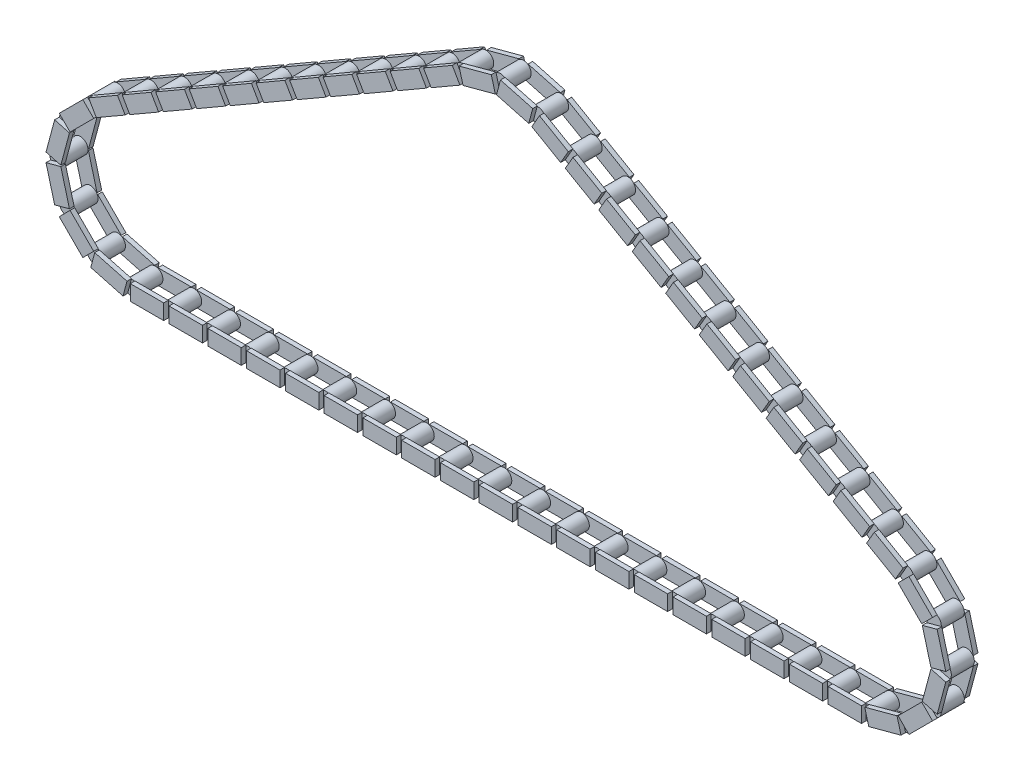
from build123d import *

# Parameters (mm, degrees)
BOTTOM_LINK_PLATES_DEPTH    = 1.2
BOTTOM_LINK_PLATES_2_DEPTH  = 1.2
BOTTOM_LINK_PLATES_3_DEPTH  = 1.2
BOTTOM_LINK_PLATES_4_DEPTH  = 1.2
BOTTOM_LINK_PLATES_5_DEPTH  = 1.2
BOTTOM_LINK_PLATES_6_DEPTH  = 1.2
BOTTOM_LINK_PLATES_7_DEPTH  = 1.2
BOTTOM_LINK_PLATES_8_DEPTH  = 1.2
BOTTOM_LINK_PLATES_9_DEPTH  = 1.2
BOTTOM_LINK_PLATES_10_DEPTH = 1.2
BOTTOM_LINK_PLATES_11_DEPTH = 1.2
BOTTOM_LINK_PLATES_12_DEPTH = 1.2
BOTTOM_LINK_PLATES_13_DEPTH = 1.2
BOTTOM_LINK_PLATES_14_DEPTH = 1.2
BOTTOM_LINK_PLATES_15_DEPTH = 1.2
BOTTOM_LINK_PLATES_16_DEPTH = 1.2
BOTTOM_LINK_PLATES_17_DEPTH = 1.2
BOTTOM_LINK_PLATES_18_DEPTH = 1.2
BOTTOM_LINK_PLATES_19_DEPTH = 1.2
BOTTOM_LINK_PLATES_20_DEPTH = 1.2
BOTTOM_LINK_PLATES_21_DEPTH = 1.2
BOTTOM_LINK_PLATES_22_DEPTH = 1.2
BOTTOM_LINK_PLATES_23_DEPTH = 1.2
BOTTOM_LINK_PLATES_24_DEPTH = 1.2
BOTTOM_LINK_PLATES_25_DEPTH = 1.2
BOTTOM_LINK_PLATES_26_DEPTH = 1.2
BOTTOM_LINK_PLATES_27_DEPTH = 1.2
BOTTOM_LINK_PLATES_28_DEPTH = 1.2
BOTTOM_LINK_PLATES_29_DEPTH = 1.2
BOTTOM_LINK_PLATES_30_DEPTH = 1.2
BOTTOM_LINK_PLATES_31_DEPTH = 1.2
BOTTOM_LINK_PLATES_32_DEPTH = 1.2
BOTTOM_LINK_PLATES_33_DEPTH = 1.2
BOTTOM_LINK_PLATES_34_DEPTH = 1.2
SKETCH_1_W                  = 8.705263365
SKETCH_1_H                  = 4
BOTTOM_LINK_PLATES_35_DEPTH = 1.2
BOTTOM_LINK_PLATES_36_DEPTH = 1.2
SKETCH_1_W_2                = 8.705263366
BOTTOM_LINK_PLATES_37_DEPTH = 1.2
BOTTOM_LINK_PLATES_38_DEPTH = 1.2
BOTTOM_LINK_PLATES_39_DEPTH = 1.2
BOTTOM_LINK_PLATES_40_DEPTH = 1.2
BOTTOM_LINK_PLATES_41_DEPTH = 1.2
BOTTOM_LINK_PLATES_42_DEPTH = 1.2
BOTTOM_LINK_PLATES_43_DEPTH = 1.2
BOTTOM_LINK_PLATES_44_DEPTH = 1.2
BOTTOM_LINK_PLATES_45_DEPTH = 1.2
BOTTOM_LINK_PLATES_46_DEPTH = 1.2
BOTTOM_LINK_PLATES_47_DEPTH = 1.2
BOTTOM_LINK_PLATES_48_DEPTH = 1.2
BOTTOM_LINK_PLATES_49_DEPTH = 1.2
BOTTOM_LINK_PLATES_50_DEPTH = 1.2
BOTTOM_LINK_PLATES_51_DEPTH = 1.2
BOTTOM_LINK_PLATES_52_DEPTH = 1.2
BOTTOM_LINK_PLATES_53_DEPTH = 1.2
SKETCH_3_R                  = 2
ROLLERS_DEPTH               = 6
SKETCH_5_W                  = 8.705263365
SKETCH_5_H                  = 4
SKETCH_5_W_2                = 8.705263366
TOP_LINK_PLATES_DEPTH       = 1.2


with BuildPart() as part:
    # 草图1 → Bottom_link_plates (new body)
    with BuildSketch(Plane.XY):
        Polygon((-97.193786169, -21.272547652), (-105.602424677, -19.019459754), (-104.567148497, -15.155756449), (-96.158509988, -17.408844347), align=None)
    extrude(amount=BOTTOM_LINK_PLATES_DEPTH)



with BuildPart() as body_2:
    # 草图1 → Bottom_link_plates 2 (new body)
    with BuildSketch(Plane.XY):
        Polygon((-107.670122975, -17.825673586), (-113.825673586, -11.670122975), (-110.997246461, -8.84169585), (-104.84169585, -14.997246461), align=None)
    extrude(amount=BOTTOM_LINK_PLATES_2_DEPTH)


with BuildPart() as body_3:
    # 草图1 → Bottom_link_plates 3 (new body)
    with BuildSketch(Plane.XY):
        Polygon((-115.019459754, -9.602424677), (-117.272547652, -1.193786169), (-113.408844347, -0.158509988), (-111.155756449, -8.567148497), align=None)
    extrude(amount=BOTTOM_LINK_PLATES_3_DEPTH)


with BuildPart() as body_4:
    # 草图1 → Bottom_link_plates 4 (new body)
    with BuildSketch(Plane.XY):
        Polygon((-117.272547652, 1.193786169), (-115.019459754, 9.602424677), (-111.155756449, 8.567148497), (-113.408844347, 0.158509988), align=None)
    extrude(amount=BOTTOM_LINK_PLATES_4_DEPTH)


with BuildPart() as body_5:
    # 草图1 → Bottom_link_plates 5 (new body)
    with BuildSketch(Plane.XY):
        Polygon((-113.825673586, 11.670122975), (-107.670122975, 17.825673586), (-104.84169585, 14.997246461), (-110.997246461, 8.84169585), align=None)
    extrude(amount=BOTTOM_LINK_PLATES_5_DEPTH)


with BuildPart() as body_6:
    # 草图1 → Bottom_link_plates 6 (new body)
    with BuildSketch(Plane.XY):
        Polygon((-106.154716463, 18.988485657), (-98.639879132, 23.32717699), (-96.639879831, 19.863074971), (-104.154717162, 15.524383638), align=None)
    extrude(amount=BOTTOM_LINK_PLATES_6_DEPTH)


with BuildPart() as body_7:
    # 草图1 → Bottom_link_plates 7 (new body)
    with BuildSketch(Plane.XY):
        Polygon((-97.427443425, 24.027176746), (-89.912606094, 28.365868079), (-87.912606794, 24.90176606), (-95.427444124, 20.563074727), align=None)
    extrude(amount=BOTTOM_LINK_PLATES_7_DEPTH)


with BuildPart() as body_8:
    # 草图1 → Bottom_link_plates 8 (new body)
    with BuildSketch(Plane.XY):
        Polygon((-88.700170388, 29.065867834), (-81.185333057, 33.404559167), (-79.185333756, 29.940457148), (-86.700171087, 25.601765815), align=None)
    extrude(amount=BOTTOM_LINK_PLATES_8_DEPTH)


with BuildPart() as body_9:
    # 草图1 → Bottom_link_plates 9 (new body)
    with BuildSketch(Plane.XY):
        Polygon((-79.97289735, 34.104558922), (-72.458060019, 38.443250255), (-70.458060718, 34.979148236), (-77.972898049, 30.640456903), align=None)
    extrude(amount=BOTTOM_LINK_PLATES_9_DEPTH)


with BuildPart() as body_10:
    # 草图1 → Bottom_link_plates 10 (new body)
    with BuildSketch(Plane.XY):
        Polygon((-71.245624312, 39.14325001), (-63.730786981, 43.481941343), (-61.730787681, 40.017839324), (-69.245625012, 35.679147991), align=None)
    extrude(amount=BOTTOM_LINK_PLATES_10_DEPTH)


with BuildPart() as body_11:
    # 草图1 → Bottom_link_plates 11 (new body)
    with BuildSketch(Plane.XY):
        Polygon((-62.518351275, 44.181941099), (-55.003513944, 48.520632432), (-53.003514643, 45.056530413), (-60.518351974, 40.71783908), align=None)
    extrude(amount=BOTTOM_LINK_PLATES_11_DEPTH)


with BuildPart() as body_12:
    # 草图1 → Bottom_link_plates 12 (new body)
    with BuildSketch(Plane.XY):
        Polygon((-53.791078237, 49.220632187), (-46.276240906, 53.55932352), (-44.276241606, 50.095221501), (-51.791078937, 45.756530168), align=None)
    extrude(amount=BOTTOM_LINK_PLATES_12_DEPTH)


with BuildPart() as body_13:
    # 草图1 → Bottom_link_plates 13 (new body)
    with BuildSketch(Plane.XY):
        Polygon((-45.0638052, 54.259323275), (-37.548967869, 58.598014608), (-35.548968568, 55.133912589), (-43.063805899, 50.795221256), align=None)
    extrude(amount=BOTTOM_LINK_PLATES_13_DEPTH)


with BuildPart() as body_14:
    # 草图1 → Bottom_link_plates 14 (new body)
    with BuildSketch(Plane.XY):
        Polygon((-36.336532162, 59.298014363), (-28.821694831, 63.636705696), (-26.821695531, 60.172603677), (-34.336532861, 55.833912344), align=None)
    extrude(amount=BOTTOM_LINK_PLATES_14_DEPTH)


with BuildPart() as body_15:
    # 草图1 → Bottom_link_plates 15 (new body)
    with BuildSketch(Plane.XY):
        Polygon((-27.609259125, 64.336705452), (-20.094421794, 68.675396785), (-18.094422493, 65.211294766), (-25.609259824, 60.872603433), align=None)
    extrude(amount=BOTTOM_LINK_PLATES_15_DEPTH)


with BuildPart() as body_16:
    # 草图1 → Bottom_link_plates 16 (new body)
    with BuildSketch(Plane.XY):
        Polygon((-18.881986087, 69.37539654), (-11.367148756, 73.714087873), (-9.367149455, 70.249985854), (-16.881986786, 65.911294521), align=None)
    extrude(amount=BOTTOM_LINK_PLATES_16_DEPTH)


with BuildPart() as body_17:
    # 草图1 → Bottom_link_plates 17 (new body)
    with BuildSketch(Plane.XY):
        Polygon((-9.602420838, 74.445061693), (-1.193781874, 76.698147893), (-0.158506473, 72.834444379), (-8.567145437, 70.581358179), align=None)
    extrude(amount=BOTTOM_LINK_PLATES_17_DEPTH)


with BuildPart() as body_18:
    # 草图1 → Bottom_link_plates 18 (new body)
    with BuildSketch(Plane.XY):
        Polygon((1.193790463, 76.698147411), (9.602428517, 74.445057816), (8.567151557, 70.58135472), (0.158513503, 72.834444315), align=None)
    extrude(amount=BOTTOM_LINK_PLATES_18_DEPTH)


with BuildPart() as body_19:
    # 草图1 → Bottom_link_plates 19 (new body)
    with BuildSketch(Plane.XY):
        Polygon((11.367155583, 73.714083931), (18.881991983, 69.375393136), (16.881992682, 65.911291117), (9.367156282, 70.249981913), align=None)
    extrude(amount=BOTTOM_LINK_PLATES_19_DEPTH)


with BuildPart() as body_20:
    # 草图1 → Bottom_link_plates 20 (new body)
    with BuildSketch(Plane.XY):
        Polygon((20.094427689, 68.675393381), (27.609264089, 64.336702585), (25.609264789, 60.872600566), (18.094428389, 65.211291362), align=None)
    extrude(amount=BOTTOM_LINK_PLATES_20_DEPTH)


with BuildPart() as body_21:
    # 草图1 → Bottom_link_plates 21 (new body)
    with BuildSketch(Plane.XY):
        Polygon((28.821699796, 63.63670283), (36.336536196, 59.298012034), (34.336536895, 55.833910015), (26.821700495, 60.172600811), align=None)
    extrude(amount=BOTTOM_LINK_PLATES_21_DEPTH)


with BuildPart() as body_22:
    # 草图1 → Bottom_link_plates 22 (new body)
    with BuildSketch(Plane.XY):
        Polygon((37.548971903, 58.598012279), (45.063808303, 54.259321484), (43.063809002, 50.795219465), (35.548972602, 55.13391026), align=None)
    extrude(amount=BOTTOM_LINK_PLATES_22_DEPTH)


with BuildPart() as body_23:
    # 草图1 → Bottom_link_plates 23 (new body)
    with BuildSketch(Plane.XY):
        Polygon((46.276244009, 53.559321728), (53.791080409, 49.220630933), (51.791081109, 45.756528914), (44.276244709, 50.095219709), align=None)
    extrude(amount=BOTTOM_LINK_PLATES_23_DEPTH)


with BuildPart() as body_24:
    # 草图1 → Bottom_link_plates 24 (new body)
    with BuildSketch(Plane.XY):
        Polygon((55.003516116, 48.520631178), (62.518352516, 44.181940382), (60.518353215, 40.717838363), (53.003516815, 45.056529159), align=None)
    extrude(amount=BOTTOM_LINK_PLATES_24_DEPTH)


with BuildPart() as body_25:
    # 草图1 → Bottom_link_plates 25 (new body)
    with BuildSketch(Plane.XY):
        Polygon((63.730788223, 43.481940627), (71.245624623, 39.143249831), (69.245625322, 35.679147812), (61.730788922, 40.017838608), align=None)
    extrude(amount=BOTTOM_LINK_PLATES_25_DEPTH)


with BuildPart() as body_26:
    # 草图1 → Bottom_link_plates 26 (new body)
    with BuildSketch(Plane.XY):
        Polygon((72.458060329, 38.443250076), (79.972896729, 34.10455928), (77.972897429, 30.640457261), (70.458061029, 34.979148057), align=None)
    extrude(amount=BOTTOM_LINK_PLATES_26_DEPTH)


with BuildPart() as body_27:
    # 草图1 → Bottom_link_plates 27 (new body)
    with BuildSketch(Plane.XY):
        Polygon((81.185332436, 33.404559525), (88.700168836, 29.06586873), (86.700169535, 25.601766711), (79.185333135, 29.940457506), align=None)
    extrude(amount=BOTTOM_LINK_PLATES_27_DEPTH)


with BuildPart() as body_28:
    # 草图1 → Bottom_link_plates 28 (new body)
    with BuildSketch(Plane.XY):
        Polygon((89.912604543, 28.365868974), (97.427440943, 24.027178179), (95.427441642, 20.56307616), (87.912605242, 24.901766955), align=None)
    extrude(amount=BOTTOM_LINK_PLATES_28_DEPTH)


with BuildPart() as body_29:
    # 草图1 → Bottom_link_plates 29 (new body)
    with BuildSketch(Plane.XY):
        Polygon((98.639876649, 23.327178424), (106.154713049, 18.988487628), (104.154713749, 15.524385609), (96.639877349, 19.863076405), align=None)
    extrude(amount=BOTTOM_LINK_PLATES_29_DEPTH)


with BuildPart() as body_30:
    # 草图1 → Bottom_link_plates 30 (new body)
    with BuildSketch(Plane.XY):
        Polygon((107.670119376, 17.825675942), (113.82567123, 11.670126574), (110.997244676, 8.841698878), (104.841692822, 14.997248246), align=None)
    extrude(amount=BOTTOM_LINK_PLATES_30_DEPTH)


with BuildPart() as body_31:
    # 草图1 → Bottom_link_plates 31 (new body)
    with BuildSketch(Plane.XY):
        Polygon((115.019457816, 9.602428517), (117.272547411, 1.193790463), (113.408844315, 0.158513503), (111.15575472, 8.567151557), align=None)
    extrude(amount=BOTTOM_LINK_PLATES_31_DEPTH)


with BuildPart() as body_32:
    # 草图1 → Bottom_link_plates 32 (new body)
    with BuildSketch(Plane.XY):
        Polygon((117.272547893, -1.193781874), (115.019461693, -9.602420838), (111.155758179, -8.567145437), (113.408844379, -0.158506473), align=None)
    extrude(amount=BOTTOM_LINK_PLATES_32_DEPTH)


with BuildPart() as body_33:
    # 草图1 → Bottom_link_plates 33 (new body)
    with BuildSketch(Plane.XY):
        Polygon((113.825675942, -11.670119376), (107.670126574, -17.82567123), (104.841698878, -14.997244676), (110.997248246, -8.841692822), align=None)
    extrude(amount=BOTTOM_LINK_PLATES_33_DEPTH)


with BuildPart() as body_34:
    # 草图1 → Bottom_link_plates 34 (new body)
    with BuildSketch(Plane.XY):
        Polygon((105.602428517, -19.019457816), (97.193790463, -21.272547411), (96.158513503, -17.408844315), (104.567151557, -15.15575472), align=None)
    extrude(amount=BOTTOM_LINK_PLATES_34_DEPTH)


with BuildPart() as body_35:
    # 草图1 → Bottom_link_plates 35 (new body)
    with BuildSketch(Plane.XY):
        with Locations((90.947372258, -19.521869331)):
            Rectangle(SKETCH_1_W, SKETCH_1_H)
    extrude(amount=BOTTOM_LINK_PLATES_35_DEPTH)


with BuildPart() as body_36:
    # 草图1 → Bottom_link_plates 36 (new body)
    with BuildSketch(Plane.XY):
        with Locations((80.842108894, -19.521869331)):
            Rectangle(SKETCH_1_W, SKETCH_1_H)
    extrude(amount=BOTTOM_LINK_PLATES_36_DEPTH)


with BuildPart() as body_37:
    # 草图1 → Bottom_link_plates 37 (new body)
    with BuildSketch(Plane.XY):
        with Locations((70.736845528, -19.521869331)):
            Rectangle(SKETCH_1_W_2, SKETCH_1_H)
    extrude(amount=BOTTOM_LINK_PLATES_37_DEPTH)


with BuildPart() as body_38:
    # 草图1 → Bottom_link_plates 38 (new body)
    with BuildSketch(Plane.XY):
        with Locations((60.631582163, -19.521869331)):
            Rectangle(SKETCH_1_W, SKETCH_1_H)
    extrude(amount=BOTTOM_LINK_PLATES_38_DEPTH)


with BuildPart() as body_39:
    # 草图1 → Bottom_link_plates 39 (new body)
    with BuildSketch(Plane.XY):
        with Locations((50.526318797, -19.521869331)):
            Rectangle(SKETCH_1_W, SKETCH_1_H)
    extrude(amount=BOTTOM_LINK_PLATES_39_DEPTH)


with BuildPart() as body_40:
    # 草图1 → Bottom_link_plates 40 (new body)
    with BuildSketch(Plane.XY):
        with Locations((40.421055432, -19.521869331)):
            Rectangle(SKETCH_1_W_2, SKETCH_1_H)
    extrude(amount=BOTTOM_LINK_PLATES_40_DEPTH)


with BuildPart() as body_41:
    # 草图1 → Bottom_link_plates 41 (new body)
    with BuildSketch(Plane.XY):
        with Locations((30.315792067, -19.521869331)):
            Rectangle(SKETCH_1_W, SKETCH_1_H)
    extrude(amount=BOTTOM_LINK_PLATES_41_DEPTH)


with BuildPart() as body_42:
    # 草图1 → Bottom_link_plates 42 (new body)
    with BuildSketch(Plane.XY):
        with Locations((20.210528702, -19.521869331)):
            Rectangle(SKETCH_1_W, SKETCH_1_H)
    extrude(amount=BOTTOM_LINK_PLATES_42_DEPTH)


with BuildPart() as body_43:
    # 草图1 → Bottom_link_plates 43 (new body)
    with BuildSketch(Plane.XY):
        with Locations((10.105265336, -19.521869331)):
            Rectangle(SKETCH_1_W_2, SKETCH_1_H)
    extrude(amount=BOTTOM_LINK_PLATES_43_DEPTH)


with BuildPart() as body_44:
    # 草图1 → Bottom_link_plates 44 (new body)
    with BuildSketch(Plane.XY):
        with Locations((1.971e-06, -19.521869331)):
            Rectangle(SKETCH_1_W, SKETCH_1_H)
    extrude(amount=BOTTOM_LINK_PLATES_44_DEPTH)


with BuildPart() as body_45:
    # 草图1 → Bottom_link_plates 45 (new body)
    with BuildSketch(Plane.XY):
        with Locations((-10.105261395, -19.521869331)):
            Rectangle(SKETCH_1_W, SKETCH_1_H)
    extrude(amount=BOTTOM_LINK_PLATES_45_DEPTH)


with BuildPart() as body_46:
    # 草图1 → Bottom_link_plates 46 (new body)
    with BuildSketch(Plane.XY):
        with Locations((-20.21052476, -19.521869331)):
            Rectangle(SKETCH_1_W_2, SKETCH_1_H)
    extrude(amount=BOTTOM_LINK_PLATES_46_DEPTH)


with BuildPart() as body_47:
    # 草图1 → Bottom_link_plates 47 (new body)
    with BuildSketch(Plane.XY):
        with Locations((-30.315788126, -19.521869331)):
            Rectangle(SKETCH_1_W, SKETCH_1_H)
    extrude(amount=BOTTOM_LINK_PLATES_47_DEPTH)


with BuildPart() as body_48:
    # 草图1 → Bottom_link_plates 48 (new body)
    with BuildSketch(Plane.XY):
        with Locations((-40.421051491, -19.521869331)):
            Rectangle(SKETCH_1_W, SKETCH_1_H)
    extrude(amount=BOTTOM_LINK_PLATES_48_DEPTH)


with BuildPart() as body_49:
    # 草图1 → Bottom_link_plates 49 (new body)
    with BuildSketch(Plane.XY):
        with Locations((-50.526314856, -19.521869331)):
            Rectangle(SKETCH_1_W_2, SKETCH_1_H)
    extrude(amount=BOTTOM_LINK_PLATES_49_DEPTH)


with BuildPart() as body_50:
    # 草图1 → Bottom_link_plates 50 (new body)
    with BuildSketch(Plane.XY):
        with Locations((-60.631578222, -19.521869331)):
            Rectangle(SKETCH_1_W, SKETCH_1_H)
    extrude(amount=BOTTOM_LINK_PLATES_50_DEPTH)


with BuildPart() as body_51:
    # 草图1 → Bottom_link_plates 51 (new body)
    with BuildSketch(Plane.XY):
        with Locations((-70.736841587, -19.521869331)):
            Rectangle(SKETCH_1_W, SKETCH_1_H)
    extrude(amount=BOTTOM_LINK_PLATES_51_DEPTH)


with BuildPart() as body_52:
    # 草图1 → Bottom_link_plates 52 (new body)
    with BuildSketch(Plane.XY):
        with Locations((-80.842104952, -19.521869331)):
            Rectangle(SKETCH_1_W_2, SKETCH_1_H)
    extrude(amount=BOTTOM_LINK_PLATES_52_DEPTH)


with BuildPart() as body_53:
    # 草图1 → Bottom_link_plates 53 (new body)
    with BuildSketch(Plane.XY):
        with Locations((-90.947368318, -19.521869331)):
            Rectangle(SKETCH_1_W, SKETCH_1_H)
    extrude(amount=BOTTOM_LINK_PLATES_53_DEPTH)


with BuildPart() as part_1:
    add(part.part)

    add(body_2.part)  # Rollers merges body 2

    add(body_3.part)  # Rollers merges body 3

    add(body_4.part)  # Rollers merges body 4

    add(body_5.part)  # Rollers merges body 5

    add(body_6.part)  # Rollers merges body 6

    add(body_7.part)  # Rollers merges body 7

    add(body_8.part)  # Rollers merges body 8

    add(body_9.part)  # Rollers merges body 9

    add(body_10.part)  # Rollers merges body 10

    add(body_11.part)  # Rollers merges body 11

    add(body_12.part)  # Rollers merges body 12

    add(body_13.part)  # Rollers merges body 13

    add(body_14.part)  # Rollers merges body 14

    add(body_15.part)  # Rollers merges body 15

    add(body_16.part)  # Rollers merges body 16

    add(body_17.part)  # Rollers merges body 17

    add(body_18.part)  # Rollers merges body 18

    add(body_19.part)  # Rollers merges body 19

    add(body_20.part)  # Rollers merges body 20

    add(body_21.part)  # Rollers merges body 21

    add(body_22.part)  # Rollers merges body 22

    add(body_23.part)  # Rollers merges body 23

    add(body_24.part)  # Rollers merges body 24

    add(body_25.part)  # Rollers merges body 25

    add(body_26.part)  # Rollers merges body 26

    add(body_27.part)  # Rollers merges body 27

    add(body_28.part)  # Rollers merges body 28

    add(body_29.part)  # Rollers merges body 29

    add(body_30.part)  # Rollers merges body 30

    add(body_31.part)  # Rollers merges body 31

    add(body_32.part)  # Rollers merges body 32

    add(body_33.part)  # Rollers merges body 33

    add(body_34.part)  # Rollers merges body 34

    add(body_35.part)  # Rollers merges body 35

    add(body_36.part)  # Rollers merges body 36

    add(body_37.part)  # Rollers merges body 37

    add(body_38.part)  # Rollers merges body 38

    add(body_39.part)  # Rollers merges body 39

    add(body_40.part)  # Rollers merges body 40

    add(body_41.part)  # Rollers merges body 41

    add(body_42.part)  # Rollers merges body 42

    add(body_43.part)  # Rollers merges body 43

    add(body_44.part)  # Rollers merges body 44

    add(body_45.part)  # Rollers merges body 45

    add(body_46.part)  # Rollers merges body 46

    add(body_47.part)  # Rollers merges body 47

    add(body_48.part)  # Rollers merges body 48

    add(body_49.part)  # Rollers merges body 49

    add(body_50.part)  # Rollers merges body 50

    add(body_51.part)  # Rollers merges body 51

    add(body_52.part)  # Rollers merges body 52

    add(body_53.part)  # Rollers merges body 53
    # 草图3 → Rollers (add)
    with BuildSketch(Plane.XY.offset(1.2)):
        with Locations(Location((-96, -19.521869331, 0), (0, 0, 234.512684885))):
            Circle(SKETCH_3_R)
        with Locations(Location((-105.760934666, -16.90643477, 0), (0, 0, 204.512684885))):
            Circle(SKETCH_3_R)
        with Locations(Location((-112.90643477, -9.760934666, 0), (0, 0, 174.512684885))):
            Circle(SKETCH_3_R)
        with Locations(Location((-115.521869331, 0, 0), (0, 0, 144.512684885))):
            Circle(SKETCH_3_R)
        with Locations(Location((-112.90643477, 9.760934666, 0), (0, 0, 185.487315115))):
            Circle(SKETCH_3_R)
        with Locations(Location((-105.760934666, 16.90643477, 0), (0, 0, 155.487315115))):
            Circle(SKETCH_3_R)
        with Locations(Location((-97.033661628, 21.945125859, 0), (0, 0, 140.487303547))):
            Circle(SKETCH_3_R)
        with Locations(Location((-88.306388591, 26.983816947, 0), (0, 0, 140.487303547))):
            Circle(SKETCH_3_R)
        with Locations(Location((-79.579115553, 32.022508035, 0), (0, 0, 140.487303547))):
            Circle(SKETCH_3_R)
        with Locations(Location((-70.851842515, 37.061199123, 0), (0, 0, 140.487303547))):
            Circle(SKETCH_3_R)
        with Locations(Location((-62.124569478, 42.099890211, 0), (0, 0, 140.487303547))):
            Circle(SKETCH_3_R)
        with Locations(Location((-53.39729644, 47.1385813, 0), (0, 0, 140.487303547))):
            Circle(SKETCH_3_R)
        with Locations(Location((-44.670023403, 52.177272388, 0), (0, 0, 140.487303547))):
            Circle(SKETCH_3_R)
        with Locations(Location((-35.942750365, 57.215963476, 0), (0, 0, 140.487303547))):
            Circle(SKETCH_3_R)
        with Locations(Location((-27.215477328, 62.254654564, 0), (0, 0, 140.487303547))):
            Circle(SKETCH_3_R)
        with Locations(Location((-18.48820429, 67.293345653, 0), (0, 0, 140.487303547))):
            Circle(SKETCH_3_R)
        with Locations(Location((-9.760931252, 72.332036741, 0), (0, 0, 140.487303547))):
            Circle(SKETCH_3_R)
        with Locations(Location((3.941e-06, 74.947469331, 0), (0, 0, 125.487303547))):
            Circle(SKETCH_3_R)
        with Locations(Location((9.760938079, 72.3320328, 0), (0, 0, 234.512673318))):
            Circle(SKETCH_3_R)
        with Locations(Location((18.488210186, 67.293342249, 0), (0, 0, 219.512696453))):
            Circle(SKETCH_3_R)
        with Locations(Location((27.215482292, 62.254651698, 0), (0, 0, 219.512696453))):
            Circle(SKETCH_3_R)
        with Locations(Location((35.942754399, 57.215961147, 0), (0, 0, 219.512696453))):
            Circle(SKETCH_3_R)
        with Locations(Location((44.670026506, 52.177270596, 0), (0, 0, 219.512696453))):
            Circle(SKETCH_3_R)
        with Locations(Location((53.397298612, 47.138580046, 0), (0, 0, 219.512696453))):
            Circle(SKETCH_3_R)
        with Locations(Location((62.124570719, 42.099889495, 0), (0, 0, 219.512696453))):
            Circle(SKETCH_3_R)
        with Locations(Location((70.851842826, 37.061198944, 0), (0, 0, 219.512696453))):
            Circle(SKETCH_3_R)
        with Locations(Location((79.579114932, 32.022508393, 0), (0, 0, 219.512696453))):
            Circle(SKETCH_3_R)
        with Locations(Location((88.306387039, 26.983817843, 0), (0, 0, 219.512696453))):
            Circle(SKETCH_3_R)
        with Locations(Location((97.033659146, 21.945127292, 0), (0, 0, 219.512696453))):
            Circle(SKETCH_3_R)
        with Locations(Location((105.760931252, 16.906436741, 0), (0, 0, 219.512696453))):
            Circle(SKETCH_3_R)
        with Locations(Location((112.9064328, 9.760938079, 0), (0, 0, 204.512696453))):
            Circle(SKETCH_3_R)
        with Locations(Location((115.521869331, 3.941e-06, 0), (0, 0, 174.512696453))):
            Circle(SKETCH_3_R)
        with Locations(Location((112.906436741, -9.760931252, 0), (0, 0, 155.487326682))):
            Circle(SKETCH_3_R)
        with Locations(Location((105.760938079, -16.9064328, 0), (0, 0, 125.487326682))):
            Circle(SKETCH_3_R)
        with Locations(Location((96.000003941, -19.521869331, 0), (0, 0, 249.512684885))):
            Circle(SKETCH_3_R)
        with Locations(Location((85.894740576, -19.521869331, 0), (0, 0, 110.487315115))):
            Circle(SKETCH_3_R)
        with Locations(Location((75.789477211, -19.521869331, 0), (0, 0, 249.512684885))):
            Circle(SKETCH_3_R)
        with Locations(Location((65.684213845, -19.521869331, 0), (0, 0, 110.487315115))):
            Circle(SKETCH_3_R)
        with Locations(Location((55.57895048, -19.521869331, 0), (0, 0, 110.487315115))):
            Circle(SKETCH_3_R)
        with Locations(Location((45.473687115, -19.521869331, 0), (0, 0, 110.487315115))):
            Circle(SKETCH_3_R)
        with Locations(Location((35.368423749, -19.521869331, 0), (0, 0, 110.487315115))):
            Circle(SKETCH_3_R)
        with Locations(Location((25.263160384, -19.521869331, 0), (0, 0, 249.512684885))):
            Circle(SKETCH_3_R)
        with Locations(Location((15.157897019, -19.521869331, 0), (0, 0, 110.487315115))):
            Circle(SKETCH_3_R)
        with Locations(Location((5.052633653, -19.521869331, 0), (0, 0, 110.487315115))):
            Circle(SKETCH_3_R)
        with Locations(Location((-5.052629712, -19.521869331, 0), (0, 0, 110.487315115))):
            Circle(SKETCH_3_R)
        with Locations(Location((-15.157893077, -19.521869331, 0), (0, 0, 110.487315115))):
            Circle(SKETCH_3_R)
        with Locations(Location((-25.263156443, -19.521869331, 0), (0, 0, 249.512684885))):
            Circle(SKETCH_3_R)
        with Locations(Location((-35.368419808, -19.521869331, 0), (0, 0, 110.487315115))):
            Circle(SKETCH_3_R)
        with Locations(Location((-45.473683173, -19.521869331, 0), (0, 0, 110.487315115))):
            Circle(SKETCH_3_R)
        with Locations(Location((-55.578946539, -19.521869331, 0), (0, 0, 110.487315115))):
            Circle(SKETCH_3_R)
        with Locations(Location((-65.684209904, -19.521869331, 0), (0, 0, 110.487315115))):
            Circle(SKETCH_3_R)
        with Locations(Location((-75.789473269, -19.521869331, 0), (0, 0, 249.512684885))):
            Circle(SKETCH_3_R)
        with Locations(Location((-85.894736635, -19.521869331, 0), (0, 0, 249.512684885))):
            Circle(SKETCH_3_R)
    extrude(amount=ROLLERS_DEPTH)

    # 草图5 → Top_link_plates (add)
    with BuildSketch(Plane.XY.offset(7.2)):
        Polygon((-97.193786169, -21.272547652), (-105.602424677, -19.019459754), (-104.567148497, -15.155756449), (-96.158509988, -17.408844347), align=None)
        Polygon((-107.670122975, -17.825673586), (-113.825673586, -11.670122975), (-110.997246461, -8.84169585), (-104.84169585, -14.997246461), align=None)
        Polygon((-115.019459754, -9.602424677), (-117.272547652, -1.193786169), (-113.408844347, -0.158509988), (-111.155756449, -8.567148497), align=None)
        Polygon((-117.272547652, 1.193786169), (-115.019459754, 9.602424677), (-111.155756449, 8.567148497), (-113.408844347, 0.158509988), align=None)
        Polygon((-113.825673586, 11.670122975), (-107.670122975, 17.825673586), (-104.84169585, 14.997246461), (-110.997246461, 8.84169585), align=None)
        Polygon((-106.154716463, 18.988485657), (-98.639879132, 23.32717699), (-96.639879831, 19.863074971), (-104.154717162, 15.524383638), align=None)
        Polygon((-97.427443425, 24.027176746), (-89.912606094, 28.365868079), (-87.912606794, 24.90176606), (-95.427444124, 20.563074727), align=None)
        Polygon((-88.700170388, 29.065867834), (-81.185333057, 33.404559167), (-79.185333756, 29.940457148), (-86.700171087, 25.601765815), align=None)
        Polygon((-79.97289735, 34.104558922), (-72.458060019, 38.443250255), (-70.458060718, 34.979148236), (-77.972898049, 30.640456903), align=None)
        Polygon((-71.245624312, 39.14325001), (-63.730786981, 43.481941343), (-61.730787681, 40.017839324), (-69.245625012, 35.679147991), align=None)
        Polygon((-62.518351275, 44.181941099), (-55.003513944, 48.520632432), (-53.003514643, 45.056530413), (-60.518351974, 40.71783908), align=None)
        Polygon((-53.791078237, 49.220632187), (-46.276240906, 53.55932352), (-44.276241606, 50.095221501), (-51.791078937, 45.756530168), align=None)
        Polygon((-45.0638052, 54.259323275), (-37.548967869, 58.598014608), (-35.548968568, 55.133912589), (-43.063805899, 50.795221256), align=None)
        Polygon((-36.336532162, 59.298014363), (-28.821694831, 63.636705696), (-26.821695531, 60.172603677), (-34.336532861, 55.833912344), align=None)
        Polygon((-27.609259125, 64.336705452), (-20.094421794, 68.675396785), (-18.094422493, 65.211294766), (-25.609259824, 60.872603433), align=None)
        Polygon((-18.881986087, 69.37539654), (-11.367148756, 73.714087873), (-9.367149455, 70.249985854), (-16.881986786, 65.911294521), align=None)
        Polygon((-9.602420838, 74.445061693), (-1.193781874, 76.698147893), (-0.158506473, 72.834444379), (-8.567145437, 70.581358179), align=None)
        Polygon((1.193790463, 76.698147411), (9.602428517, 74.445057816), (8.567151557, 70.58135472), (0.158513503, 72.834444315), align=None)
        Polygon((11.367155583, 73.714083931), (18.881991983, 69.375393136), (16.881992682, 65.911291117), (9.367156282, 70.249981913), align=None)
        Polygon((20.094427689, 68.675393381), (27.609264089, 64.336702585), (25.609264789, 60.872600566), (18.094428389, 65.211291362), align=None)
        Polygon((28.821699796, 63.63670283), (36.336536196, 59.298012034), (34.336536895, 55.833910015), (26.821700495, 60.172600811), align=None)
        Polygon((37.548971903, 58.598012279), (45.063808303, 54.259321484), (43.063809002, 50.795219465), (35.548972602, 55.13391026), align=None)
        Polygon((46.276244009, 53.559321728), (53.791080409, 49.220630933), (51.791081109, 45.756528914), (44.276244709, 50.095219709), align=None)
        Polygon((55.003516116, 48.520631178), (62.518352516, 44.181940382), (60.518353215, 40.717838363), (53.003516815, 45.056529159), align=None)
        Polygon((63.730788223, 43.481940627), (71.245624623, 39.143249831), (69.245625322, 35.679147812), (61.730788922, 40.017838608), align=None)
        Polygon((72.458060329, 38.443250076), (79.972896729, 34.10455928), (77.972897429, 30.640457261), (70.458061029, 34.979148057), align=None)
        Polygon((81.185332436, 33.404559525), (88.700168836, 29.06586873), (86.700169535, 25.601766711), (79.185333135, 29.940457506), align=None)
        Polygon((89.912604543, 28.365868974), (97.427440943, 24.027178179), (95.427441642, 20.56307616), (87.912605242, 24.901766955), align=None)
        Polygon((98.639876649, 23.327178424), (106.154713049, 18.988487628), (104.154713749, 15.524385609), (96.639877349, 19.863076405), align=None)
        Polygon((107.670119376, 17.825675942), (113.82567123, 11.670126574), (110.997244676, 8.841698878), (104.841692822, 14.997248246), align=None)
        Polygon((115.019457816, 9.602428517), (117.272547411, 1.193790463), (113.408844315, 0.158513503), (111.15575472, 8.567151557), align=None)
        Polygon((117.272547893, -1.193781874), (115.019461693, -9.602420838), (111.155758179, -8.567145437), (113.408844379, -0.158506473), align=None)
        Polygon((113.825675942, -11.670119376), (107.670126574, -17.82567123), (104.841698878, -14.997244676), (110.997248246, -8.841692822), align=None)
        Polygon((105.602428517, -19.019457816), (97.193790463, -21.272547411), (96.158513503, -17.408844315), (104.567151557, -15.15575472), align=None)
        with Locations((90.947372258, -19.521869331)):
            Rectangle(SKETCH_5_W, SKETCH_5_H)
        with Locations((80.842108894, -19.521869331)):
            Rectangle(SKETCH_5_W, SKETCH_5_H)
        with Locations((70.736845528, -19.521869331)):
            Rectangle(SKETCH_5_W_2, SKETCH_5_H)
        with Locations((60.631582163, -19.521869331)):
            Rectangle(SKETCH_5_W, SKETCH_5_H)
        with Locations((50.526318797, -19.521869331)):
            Rectangle(SKETCH_5_W, SKETCH_5_H)
        with Locations((40.421055432, -19.521869331)):
            Rectangle(SKETCH_5_W_2, SKETCH_5_H)
        with Locations((30.315792067, -19.521869331)):
            Rectangle(SKETCH_5_W, SKETCH_5_H)
        with Locations((20.210528702, -19.521869331)):
            Rectangle(SKETCH_5_W, SKETCH_5_H)
        with Locations((10.105265336, -19.521869331)):
            Rectangle(SKETCH_5_W_2, SKETCH_5_H)
        with Locations((1.971e-06, -19.521869331)):
            Rectangle(SKETCH_5_W, SKETCH_5_H)
        with Locations((-10.105261395, -19.521869331)):
            Rectangle(SKETCH_5_W, SKETCH_5_H)
        with Locations((-20.21052476, -19.521869331)):
            Rectangle(SKETCH_5_W_2, SKETCH_5_H)
        with Locations((-30.315788126, -19.521869331)):
            Rectangle(SKETCH_5_W, SKETCH_5_H)
        with Locations((-40.421051491, -19.521869331)):
            Rectangle(SKETCH_5_W, SKETCH_5_H)
        with Locations((-50.526314856, -19.521869331)):
            Rectangle(SKETCH_5_W_2, SKETCH_5_H)
        with Locations((-60.631578222, -19.521869331)):
            Rectangle(SKETCH_5_W, SKETCH_5_H)
        with Locations((-70.736841587, -19.521869331)):
            Rectangle(SKETCH_5_W, SKETCH_5_H)
        with Locations((-80.842104952, -19.521869331)):
            Rectangle(SKETCH_5_W_2, SKETCH_5_H)
        with Locations((-90.947368318, -19.521869331)):
            Rectangle(SKETCH_5_W, SKETCH_5_H)
    extrude(amount=TOP_LINK_PLATES_DEPTH)


solid = part_1.part
